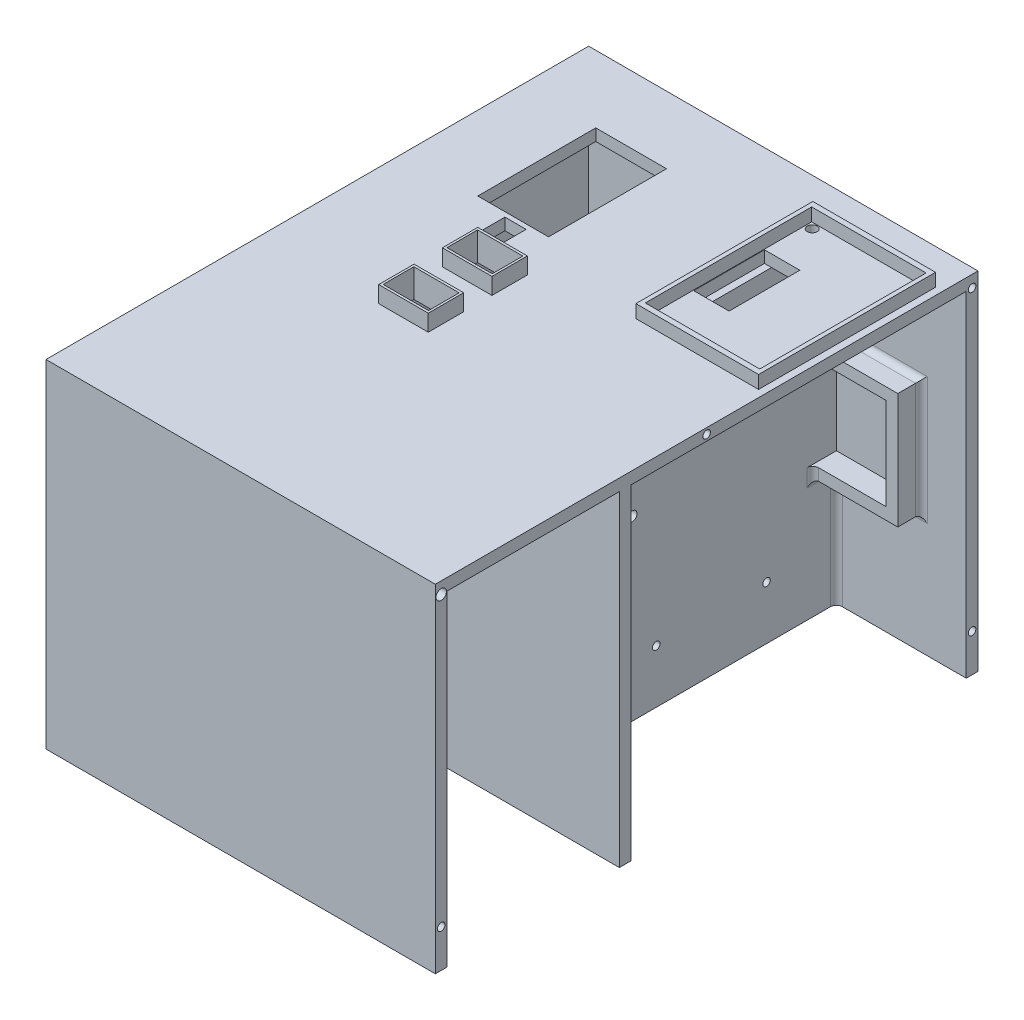
from build123d import *

# Parameters (mm, degrees)
SKETCH_1_W           = 142
SKETCH_1_H           = 142
EXTRUDE_1_DEPTH      = 5
SKETCH_2_W           = 5
SKETCH_2_H           = 142
EXTRUDE_2_DEPTH      = 5
SKETCH_3_W           = 142
SKETCH_3_H           = 5
EXTRUDE_3_DEPTH      = 60
SKETCH_4_W           = 31
SKETCH_4_H           = 71
CUT_EXTRUDE_1_DEPTH  = 5
SKETCH_5_W           = 142
SKETCH_5_H           = 5
EXTRUDE_4_DEPTH      = 40
EXTRUDE_5_DEPTH      = 5
SKETCH_7_W           = 5
SKETCH_7_H           = 142
EXTRUDE_6_DEPTH      = 100
SKETCH_8_W           = 40
SKETCH_8_H           = 40
EXTRUDE_7_DEPTH      = 25
SKETCH_10_W          = 35.5
SKETCH_10_H          = 35.5
CUT_EXTRUDE_2_DEPTH  = 30
EXTRUDE_8_DEPTH      = 5
SKETCH_13_W          = 5
SKETCH_13_H          = 142
EXTRUDE_9_DEPTH      = 100
EXTRUDE_10_DEPTH     = 5
SKETCH_15_W          = 142
SKETCH_15_H          = 5
EXTRUDE_11_DEPTH     = 100
SKETCH_16_W          = 21
SKETCH_16_H          = 15
EXTRUDE_12_DEPTH     = 7
SKETCH_17_W          = 19.2
SKETCH_17_H          = 13
CUT_EXTRUDE_4_DEPTH  = 12
SKETCH_18_W          = 19.2
SKETCH_18_H          = 13
CUT_EXTRUDE_5_DEPTH  = 12
CUT_EXTRUDE_6_DEPTH  = 10
SKETCH_20_W          = 30
SKETCH_20_H          = 50
CUT_EXTRUDE_7_DEPTH  = 5
SKETCH_21_W          = 9
SKETCH_21_H          = 15.5
CUT_EXTRUDE_8_DEPTH  = 5
SKETCH_22_W          = 152
SKETCH_22_H          = 152
EXTRUDE_13_DEPTH     = 5
SKETCH_23_W          = 142
SKETCH_23_H          = 5
CUT_EXTRUDE_9_DEPTH  = 5
SKETCH_25_R          = 2
CUT_EXTRUDE_11_DEPTH = 5
SKETCH_26_W          = 5
SKETCH_26_H          = 152
EXTRUDE_14_DEPTH     = 55
EXTRUDE_15_DEPTH     = 10
SKETCH_29_W          = 5
SKETCH_29_H          = 152
CUT_EXTRUDE_12_DEPTH = 110
SKETCH_30_W          = 5
SKETCH_30_H          = 15.68203055
EXTRUDE_16_DEPTH     = 5
SKETCH_37_W          = 142
SKETCH_37_H          = 5
EXTRUDE_17_DEPTH     = 55
SKETCH_38_W          = 52
SKETCH_38_H          = 75
EXTRUDE_18_DEPTH     = 10.5
SKETCH_39_W          = 48.5
SKETCH_39_H          = 70.5
CUT_EXTRUDE_14_DEPTH = 5.5
SKETCH_40_R          = 2.1
CUT_EXTRUDE_16_DEPTH = 5
SKETCH_41_W          = 15
SKETCH_41_H          = 30
CUT_EXTRUDE_17_DEPTH = 5
CUT_EXTRUDE_18_DEPTH = 5
EXTRUDE_19_DEPTH     = 75
SKETCH_45_W          = 2
SKETCH_45_H          = 138
EXTRUDE_20_DEPTH     = 160
SKETCH_46_W          = 73
SKETCH_46_H          = 133
CUT_EXTRUDE_19_DEPTH = 5
EXTRUDE_21_DEPTH     = 8
SKETCH_49_W          = 5
SKETCH_49_H          = 138
EXTRUDE_22_DEPTH     = 160
SKETCH_50_W          = 100
SKETCH_50_H          = 4
EXTRUDE_23_DEPTH     = 5
SKETCH_51_W          = 83
SKETCH_51_H          = 9
EXTRUDE_24_DEPTH     = 110
EXTRUDE_25_DEPTH     = 3
SKETCH_54_W          = 9
SKETCH_54_H          = 15.5
CUT_EXTRUDE_20_DEPTH = 5
CUT_EXTRUDE_21_DEPTH = 110
SKETCH_58_W          = 5.929786703
SKETCH_58_H          = 5
EXTRUDE_26_DEPTH     = 5
CUT_EXTRUDE_START    = -55
SKETCH_60_W          = 5
SKETCH_60_H          = 5
CUT_EXTRUDE_22_DEPTH = 55
SKETCH_59_R          = 1.6
CUT_EXTRUDE_23_DEPTH = 6
SKETCH_61_R          = 1.6
CUT_EXTRUDE_24_DEPTH = 10
SKETCH_62_R          = 1.6
SKETCH_62_R_2        = 2.201608842
CUT_EXTRUDE_25_DEPTH = 6
FILLET_1_R           = 2.5


with BuildPart() as part:
    # 草图1 → 凸台-拉伸1 (new body)
    with BuildSketch(Plane(origin=(0, 0, 0), x_dir=(0, 0, -1), z_dir=(1, 0, 0))):
        Rectangle(SKETCH_1_W, SKETCH_1_H)
    extrude(amount=EXTRUDE_1_DEPTH)

    # 草图2 → 凸台-拉伸2 (add)
    with BuildSketch(Plane.XZ.offset(71)):
        with Locations((2.5, 0)):
            Rectangle(SKETCH_2_W, SKETCH_2_H)
    extrude(amount=EXTRUDE_2_DEPTH)

    # 草图3 → 凸台-拉伸3 (add)
    with BuildSketch(Plane(origin=(5, 0, 0), x_dir=(0, 0, -1), z_dir=(1, 0, 0))):
        with Locations((0, -73.5)):
            Rectangle(SKETCH_3_W, SKETCH_3_H)
    extrude(amount=EXTRUDE_3_DEPTH)

    # 草图4 → 切除-拉伸1 (cut)
    with BuildSketch(Plane.XZ.offset(76)):
        with Locations((49.5, 9.5)):
            Rectangle(SKETCH_4_W, SKETCH_4_H)
    extrude(amount=-CUT_EXTRUDE_1_DEPTH, mode=Mode.SUBTRACT)

    # 草图5 → 凸台-拉伸4 (add)
    with BuildSketch(Plane(origin=(65, 0, 0), x_dir=(0, 0, -1), z_dir=(1, 0, 0))):
        with Locations((0, -73.5)):
            Rectangle(SKETCH_5_W, SKETCH_5_H)
    extrude(amount=EXTRUDE_4_DEPTH)

    # 草图6 → 凸台-拉伸5 (add)
    with BuildSketch(Plane(origin=(0, 0, -71), x_dir=(-1, 0, 0), z_dir=(0, 0, -1))):
        Polygon((0, -76), (0, 71), (-5, 71), (-5, -71), (-105, -71), (-105, -76), align=None)
    extrude(amount=EXTRUDE_5_DEPTH)

    # 草图7 → 凸台-拉伸6 (add)
    with BuildSketch(Plane(origin=(5, 0, 0), x_dir=(0, 0, -1), z_dir=(1, 0, 0))):
        with Locations((73.5, 0)):
            Rectangle(SKETCH_7_W, SKETCH_7_H)
    extrude(amount=EXTRUDE_6_DEPTH)

    # 草图8 → 凸台-拉伸7 (add)
    with BuildSketch(Plane(origin=(0, 0, -76), x_dir=(-1, 0, 0), z_dir=(0, 0, -1))):
        with Locations((-75, -26)):
            Rectangle(SKETCH_8_W, SKETCH_8_H)
    extrude(amount=EXTRUDE_7_DEPTH)

    # 草图10 → 切除-拉伸2 (cut)
    with BuildSketch(Plane(origin=(0, 0, -101), x_dir=(-1, 0, 0), z_dir=(0, 0, -1))):
        with Locations((-75, -26)):
            Rectangle(SKETCH_10_W, SKETCH_10_H)
    extrude(amount=-CUT_EXTRUDE_2_DEPTH, mode=Mode.SUBTRACT)

    # 草图12 → 凸台-拉伸8 (add)
    with BuildSketch(Plane.XY.offset(71)):
        Polygon((0, 71), (0, -76), (105, -76), (105, -71), (5, -71), (5, 71), align=None)
    extrude(amount=EXTRUDE_8_DEPTH)

    # 草图13 → 凸台-拉伸9 (add)
    with BuildSketch(Plane(origin=(5, 0, 0), x_dir=(0, 0, -1), z_dir=(1, 0, 0))):
        with Locations((-73.5, 0)):
            Rectangle(SKETCH_13_W, SKETCH_13_H)
    extrude(amount=EXTRUDE_9_DEPTH)

    # 草图14 → 凸台-拉伸10 (add)
    with BuildSketch(Plane(origin=(0, 71, 0), x_dir=(1, 0, 0), z_dir=(0, 1, 0))):
        Polygon((0, 76), (0, -76), (105, -76), (105, -71), (5, -71), (5, 71), (105, 71), (105, 76), align=None)
    extrude(amount=EXTRUDE_10_DEPTH)

    # 草图15 → 凸台-拉伸11 (add)
    with BuildSketch(Plane(origin=(5, 0, 0), x_dir=(0, 0, -1), z_dir=(1, 0, 0))):
        with Locations((0, 73.5)):
            Rectangle(SKETCH_15_W, SKETCH_15_H)
    extrude(amount=EXTRUDE_11_DEPTH)

    # 草图16 → 凸台-拉伸12 (add)
    with BuildSketch(Plane(origin=(0, 76, 0), x_dir=(1, 0, 0), z_dir=(0, 1, 0))):
        with Locations((60.5, -28.5)):
            Rectangle(SKETCH_16_W, SKETCH_16_H)
        with Locations((60.5, -55.5)):
            Rectangle(SKETCH_16_W, SKETCH_16_H)
    extrude(amount=EXTRUDE_12_DEPTH)

    # 草图17 → 切除-拉伸4 (cut)
    with BuildSketch(Plane(origin=(0, 83, 0), x_dir=(1, 0, 0), z_dir=(0, 1, 0))):
        with Locations((60.5, -28.5)):
            Rectangle(SKETCH_17_W, SKETCH_17_H)
    extrude(amount=-CUT_EXTRUDE_4_DEPTH, mode=Mode.SUBTRACT)

    # 草图18 → 切除-拉伸5 (cut)
    with BuildSketch(Plane(origin=(0, 83, 0), x_dir=(1, 0, 0), z_dir=(0, 1, 0))):
        with Locations((60.5, -55.5)):
            Rectangle(SKETCH_18_W, SKETCH_18_H)
    extrude(amount=-CUT_EXTRUDE_5_DEPTH, mode=Mode.SUBTRACT)

    # 草图19 → 切除-拉伸6 (cut)
    with BuildSketch(Plane(origin=(10, 0, 0), x_dir=(0, 0, -1), z_dir=(1, 0, 0))):
        with BuildLine():
            ThreePointArc((57.15477013, -53.472274575), (55.552230124, -55.069734569), (57.149690119, -56.672274575))
            ThreePointArc((57.149690119, -56.672274575), (58.752230124, -55.07481458), (57.15477013, -53.472274575))
        make_face()
        with BuildLine():
            ThreePointArc((-57.399458979, -53.472274575), (-59.001998984, -55.069734569), (-57.404538989, -56.672274575))
            ThreePointArc((-57.404538989, -56.672274575), (-55.801998984, -55.07481458), (-57.399458979, -53.472274575))
        make_face()
        with BuildLine():
            ThreePointArc((57.916771654, 56.675), (56.314231648, 55.077540005), (57.911691643, 53.475))
            ThreePointArc((57.911691643, 53.475), (59.514231648, 55.072459995), (57.916771654, 56.675))
        make_face()
        with BuildLine():
            ThreePointArc((-57.907459995, 56.675), (-59.51, 55.077540005), (-57.912540005, 53.475))
            ThreePointArc((-57.912540005, 53.475), (-56.31, 55.072459995), (-57.907459995, 56.675))
        make_face()
    extrude(amount=-CUT_EXTRUDE_6_DEPTH, mode=Mode.SUBTRACT)

    # 草图20 → 切除-拉伸7 (cut)
    with BuildSketch(Plane(origin=(0, 76, 0), x_dir=(1, 0, 0), z_dir=(0, 1, 0))):
        with Locations((46.5, 22.5)):
            Rectangle(SKETCH_20_W, SKETCH_20_H)
    extrude(amount=-CUT_EXTRUDE_7_DEPTH, mode=Mode.SUBTRACT)

    # 草图21 → 切除-拉伸8 (cut)
    with BuildSketch(Plane(origin=(0, 76, 0), x_dir=(1, 0, 0), z_dir=(0, 1, 0))):
        with Locations((49.5, -12.25)):
            Rectangle(SKETCH_21_W, SKETCH_21_H)
    extrude(amount=-CUT_EXTRUDE_8_DEPTH, mode=Mode.SUBTRACT)

    # 草图22 → 凸台-拉伸13 (add)
    with BuildSketch(Plane(origin=(105, 0, 0), x_dir=(0, 0, -1), z_dir=(1, 0, 0))):
        Rectangle(SKETCH_22_W, SKETCH_22_H)
    extrude(amount=EXTRUDE_13_DEPTH)

    # 草图23 → 切除-拉伸9 (cut)
    with BuildSketch(Plane(origin=(110, 0, 0), x_dir=(0, 0, -1), z_dir=(1, 0, 0))):
        with Locations((0, 68.5)):
            Rectangle(SKETCH_23_W, SKETCH_23_H)
    extrude(amount=-CUT_EXTRUDE_9_DEPTH, mode=Mode.SUBTRACT)

    # 草图25 → 切除-拉伸11 (cut)
    with BuildSketch(Plane(origin=(110, 0, 0), x_dir=(0, 0, -1), z_dir=(1, 0, 0))):
        with Locations((-15.5, 4.201010127)):
            Circle(SKETCH_25_R)
        with Locations((-56.5, 4.201010127)):
            Circle(SKETCH_25_R)
        with Locations((-56.5, 43.798989873)):
            Circle(SKETCH_25_R)
        with Locations((-15.5, 43.798989873)):
            Circle(SKETCH_25_R)
    extrude(amount=-CUT_EXTRUDE_11_DEPTH, mode=Mode.SUBTRACT)

    # 草图26 → 凸台-拉伸14 (add)
    with BuildSketch(Plane(origin=(110, 0, 0), x_dir=(0, 0, -1), z_dir=(1, 0, 0))):
        with Locations((73.5, 0)):
            Rectangle(SKETCH_26_W, SKETCH_26_H)
    extrude(amount=EXTRUDE_14_DEPTH)

    # 草图28 → 凸台-拉伸15 (add)
    with BuildSketch(Plane.XY.offset(-71)):
        Polygon((110, -15), (141, -15), (141, 24), (110, 24), (110, 29), (146, 29), (146, -6), (146, -15), (146, -20), (110, -20), align=None)
    extrude(amount=EXTRUDE_15_DEPTH)

    # 草图29 → 切除-拉伸12 (cut)
    with BuildSketch(Plane(origin=(110, 0, 0), x_dir=(0, 0, -1), z_dir=(1, 0, 0))):
        with Locations((-73.5, 0)):
            Rectangle(SKETCH_29_W, SKETCH_29_H)
    extrude(amount=-CUT_EXTRUDE_12_DEPTH, mode=Mode.SUBTRACT)

    # 草图30 → 凸台-拉伸16 (add)
    with BuildSketch(Plane(origin=(110, 0, 0), x_dir=(0, 0, -1), z_dir=(1, 0, 0))):
        with Locations((68.5, 68.158984725)):
            Rectangle(SKETCH_30_W, SKETCH_30_H)
    extrude(amount=-EXTRUDE_16_DEPTH)

    # 草图37 → 凸台-拉伸17 (add)
    with BuildSketch(Plane(origin=(110, 0, 0), x_dir=(0, 0, -1), z_dir=(1, 0, 0))):
        with Locations((0, 73.5)):
            Rectangle(SKETCH_37_W, SKETCH_37_H)
    extrude(amount=EXTRUDE_17_DEPTH)

    # 草图38 → 凸台-拉伸18 (add)
    with BuildSketch(Plane.XZ.offset(-71)):
        with Locations((136, -23.5)):
            Rectangle(SKETCH_38_W, SKETCH_38_H)
    extrude(amount=-EXTRUDE_18_DEPTH)

    # 草图39 → 切除-拉伸14 (cut)
    with BuildSketch(Plane(origin=(0, 81.5, 0), x_dir=(1, 0, 0), z_dir=(0, 1, 0))):
        with Locations((136, 23.5)):
            Rectangle(SKETCH_39_W, SKETCH_39_H)
    extrude(amount=-CUT_EXTRUDE_14_DEPTH, mode=Mode.SUBTRACT)

    # 草图40 → 切除-拉伸16 (cut)
    with BuildSketch(Plane(origin=(0, 76, 0), x_dir=(1, 0, 0), z_dir=(0, 1, 0))):
        with Locations(Location((157.575, 56.3, 0), (0, 0, 270))):
            Circle(SKETCH_40_R)
        with Locations(Location((157.575, -9.3, 0), (0, 0, 270))):
            Circle(SKETCH_40_R)
        with Locations(Location((114.425, -9.3, 0), (0, 0, 270))):
            Circle(SKETCH_40_R)
        with Locations(Location((114.425, 56.3, 0), (0, 0, 270))):
            Circle(SKETCH_40_R)
    extrude(amount=-CUT_EXTRUDE_16_DEPTH, mode=Mode.SUBTRACT)

    # 草图41 → 切除-拉伸17 (cut)
    with BuildSketch(Plane(origin=(0, 76, 0), x_dir=(1, 0, 0), z_dir=(0, 1, 0))):
        with Locations((119.5, 23.5)):
            Rectangle(SKETCH_41_W, SKETCH_41_H)
    extrude(amount=-CUT_EXTRUDE_17_DEPTH, mode=Mode.SUBTRACT)

    # 草图42 → 切除-拉伸18 (cut)
    with BuildSketch(Plane(origin=(110, 0, 0), x_dir=(0, 0, -1), z_dir=(1, 0, 0))):
        with BuildLine():
            ThreePointArc((39.772077724, 27.58013462), (41.369537719, 25.977594615), (42.972077724, 27.57505461))
            ThreePointArc((42.972077724, 27.57505461), (41.374617729, 29.177594615), (39.772077724, 27.58013462))
        make_face()
        with BuildLine():
            ThreePointArc((42.972077724, -48.426062992), (41.374617729, -46.823522987), (39.772077724, -48.420982982))
            ThreePointArc((39.772077724, -48.420982982), (41.369537719, -50.023522987), (42.972077724, -48.426062992))
        make_face()
        with BuildLine():
            ThreePointArc((-6.971953264, -48.420982982), (-5.374493269, -50.023522987), (-3.771953264, -48.426062992))
            ThreePointArc((-3.771953264, -48.426062992), (-5.369413259, -46.823522987), (-6.971953264, -48.420982982))
        make_face()
        with BuildLine():
            ThreePointArc((-6.971953264, 27.58013462), (-5.374493269, 25.977594615), (-3.771953264, 27.57505461))
            ThreePointArc((-3.771953264, 27.57505461), (-5.369413259, 29.177594615), (-6.971953264, 27.58013462))
        make_face()
    extrude(amount=-CUT_EXTRUDE_18_DEPTH, mode=Mode.SUBTRACT)

    # 草图43 → 凸台-拉伸19 (add)
    with BuildSketch(Plane.XY.offset(71)):
        Polygon((5, 71), (165, 71), (165, 76), (0, 76), (0, -76), (110, -76), (110, 66), (105, 66), (105, -71), (5, -71), align=None)
    extrude(amount=EXTRUDE_19_DEPTH)

    # 草图45 → 凸台-拉伸20 (add)
    with BuildSketch(Plane(origin=(5, 0, 0), x_dir=(0, 0, -1), z_dir=(1, 0, 0))):
        with Locations((-72, 2)):
            Rectangle(SKETCH_45_W, SKETCH_45_H)
    extrude(amount=EXTRUDE_20_DEPTH)

    # 草图46 → 切除-拉伸19 (cut)
    with BuildSketch(Plane(origin=(110, 0, 0), x_dir=(0, 0, -1), z_dir=(1, 0, 0))):
        with Locations((-109.5, -0.5)):
            Rectangle(SKETCH_46_W, SKETCH_46_H)
    extrude(amount=-CUT_EXTRUDE_19_DEPTH, mode=Mode.SUBTRACT)

    # 草图47 → 凸台-拉伸21 (add)
    with BuildSketch(Plane.XY.offset(146)):
        Polygon((110, -67), (105, -67), (105, -71), (5, -71), (5, 71), (165, 71), (165, 76), (0, 76), (0, -76), (110, -76), align=None)
    extrude(amount=EXTRUDE_21_DEPTH)

    # 草图49 → 凸台-拉伸22 (add)
    with BuildSketch(Plane(origin=(5, 0, 0), x_dir=(0, 0, -1), z_dir=(1, 0, 0))):
        with Locations((-151.5, 2)):
            Rectangle(SKETCH_49_W, SKETCH_49_H)
    extrude(amount=EXTRUDE_22_DEPTH)

    # 草图50 → 凸台-拉伸23 (add)
    with BuildSketch(Plane.XY.offset(154)):
        with Locations((55, -69)):
            Rectangle(SKETCH_50_W, SKETCH_50_H)
    extrude(amount=-EXTRUDE_23_DEPTH)

    # 草图51 → 凸台-拉伸24 (add)
    with BuildSketch(Plane(origin=(110, 0, 0), x_dir=(0, 0, -1), z_dir=(1, 0, 0))):
        with Locations((-112.5, -71.5)):
            Rectangle(SKETCH_51_W, SKETCH_51_H)
    extrude(amount=-EXTRUDE_24_DEPTH)

    # 草图53 → 凸台-拉伸25 (add)
    with BuildSketch(Plane.XY.offset(73)):
        Polygon((5, -67), (110, -67), (165, -67), (165, 71), (5, 71), align=None)
    extrude(amount=EXTRUDE_25_DEPTH)

    # 草图54 → 切除-拉伸20 (cut)
    with BuildSketch(Plane.XY.offset(76)):
        with Locations((49.5, 46.25)):
            Rectangle(SKETCH_54_W, SKETCH_54_H)
    extrude(amount=-CUT_EXTRUDE_20_DEPTH, mode=Mode.SUBTRACT)

    # 草图57 → 切除-拉伸21 (cut)
    with BuildSketch(Plane(origin=(110, 0, 0), x_dir=(0, 0, -1), z_dir=(1, 0, 0))):
        Polygon((-154, -67), (-71, -67), (-71, -71), (76, -71), (76, -76), (-71, -76), (-154, -76), align=None)
    extrude(amount=-CUT_EXTRUDE_21_DEPTH, mode=Mode.SUBTRACT)

    # 草图58 → 凸台-拉伸26 (add)
    with BuildSketch(Plane(origin=(110, 0, 0), x_dir=(0, 0, -1), z_dir=(1, 0, 0))):
        with Locations((-68.035106649, 68.5)):
            Rectangle(SKETCH_58_W, SKETCH_58_H)
    extrude(amount=-EXTRUDE_26_DEPTH)

    # 草图60 → 切除-拉伸22 (cut)
    with BuildSketch(Plane.ZY.offset(-110).offset(CUT_EXTRUDE_START)):
        with Locations((-73.5, -73.5)):
            Rectangle(SKETCH_60_W, SKETCH_60_H)
    extrude(amount=CUT_EXTRUDE_22_DEPTH, mode=Mode.SUBTRACT)

    # 草图59 → 切除-拉伸23 (cut)
    with BuildSketch(Plane.XZ.offset(67)):
        with Locations(Location((155, 151.5, 0), (0, 0, 270))):
            Circle(SKETCH_59_R)
        with Locations(Location((3, 151.5, 0), (0, 0, 270))):
            Circle(SKETCH_59_R)
        with Locations(Location((155, 73.5, 0), (0, 0, 270))):
            Circle(SKETCH_59_R)
        with Locations(Location((3, 73.5, 0), (0, 0, 270))):
            Circle(SKETCH_59_R)
    extrude(amount=-CUT_EXTRUDE_23_DEPTH, mode=Mode.SUBTRACT)

    # 草图61 → 切除-拉伸24 (cut)
    with BuildSketch(Plane.XZ.offset(71)):
        with Locations(Location((3, -73.5, 0), (0, 0, 270))):
            Circle(SKETCH_61_R)
        with Locations(Location((155, -73.5, 0), (0, 0, 270))):
            Circle(SKETCH_61_R)
    extrude(amount=-CUT_EXTRUDE_24_DEPTH, mode=Mode.SUBTRACT)

    # 草图62 → 切除-拉伸25 (cut)
    with BuildSketch(Plane(origin=(165, 0, 0), x_dir=(0, 0, -1), z_dir=(1, 0, 0))):
        with Locations((-151.5, -51)):
            Circle(SKETCH_62_R)
        with Locations((-151.5, 71)):
            Circle(SKETCH_62_R_2)
        with Locations((-39, 73.5)):
            Circle(SKETCH_62_R)
        with Locations((73.5, -55)):
            Circle(SKETCH_62_R)
        with Locations((73.5, 71)):
            Circle(SKETCH_62_R)
    extrude(amount=-CUT_EXTRUDE_25_DEPTH, mode=Mode.SUBTRACT)

    # 圆角1
    fillet_1_edges = [part.edges().sort_by_distance(p)[0] for p in [
        (105, 0, -71),
        (110, -45.5, -71),
        (128, -20, -71),
        (110, -20, -66),
        (146, 4.5, -71),
        (128, 29, -71),
        (110, 29, -66),
        (110, -17.5, -61),
        (110, 26.5, -61),
        (110, 50, -71),
        (110, 71, -68.5),
        (110, 2, 71),
        (105, 2, 71),
        (110, 71, 68.035106649),
    ]]
    fillet(fillet_1_edges, radius=FILLET_1_R)


solid = part.part
